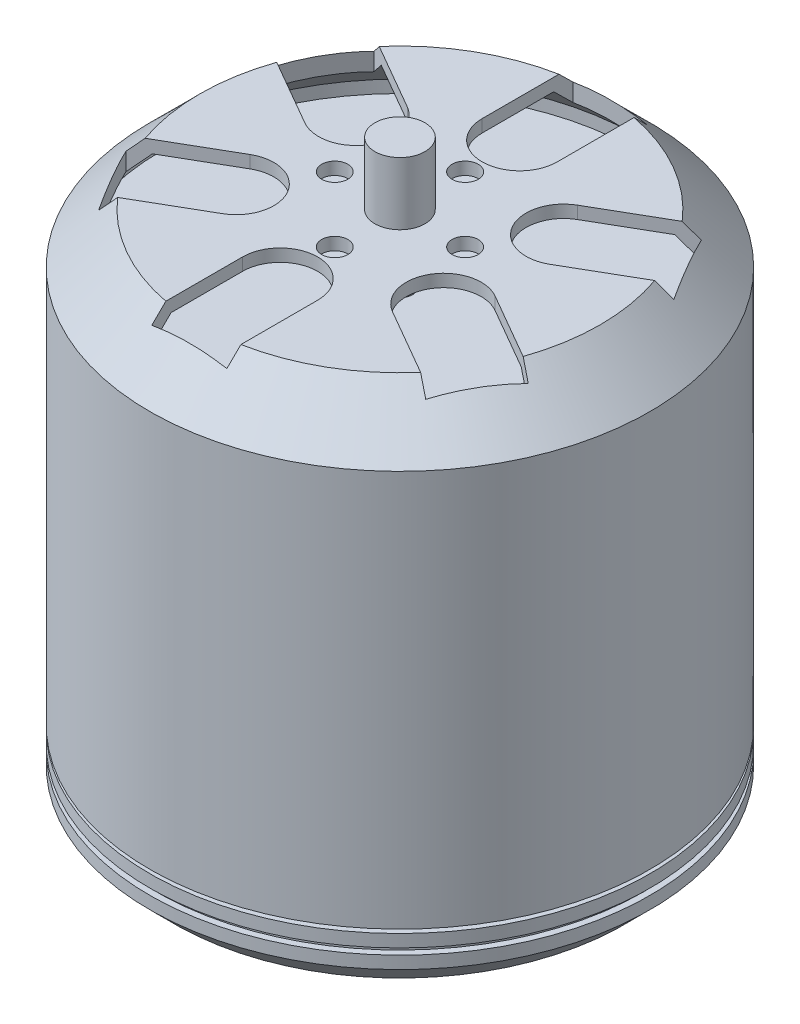
from build123d import *

# Parameters (mm, degrees)
SKETCH2_R          = 1.046208244
CUT_EXTRUDE1_DEPTH = 4
SKETCH3_R          = 1
CUT_EXTRUDE2_DEPTH = 3


with BuildPart() as part:
    # Sketch1 → Revolve1 (revolve)
    with BuildSketch(Plane.XY, mode=Mode.PRIVATE) as revolve1_sk:
        Polygon((0, 23.312815917), (0, 0), (0, -22.187184083), (10.054416675, -22.187184083), (18, -22.187184083), (20, -20.187184083), (20, -19.187184083), (19.5, -19.187184083), (19.5, -18.687184083), (20, -18.687184083), (20, -17.687184083), (18, -17.687184083), (18, -17.387184083), (20, -17.387184083), (20, 14.312815917), (16, 18.312815917), (2, 18.312815917), (2, 23.312815917), align=None)
        Polygon((2, 17.312815917), (15.585786438, 17.312815917), (19, 13.898602354), (19, 12.898602354), (1, 12.898602354), (1, 16.312815917), (2, 16.312815917), align=None, mode=Mode.SUBTRACT)
    revolve(revolve1_sk.sketch.rotate(Axis((0, 23.312815917, 0), (0, -1, 0)), 180), axis=Axis((0, 23.312815917, 0), (0, -1, 0)))

    # Sketch2 → Cut-Extrude1 (cut)
    with BuildSketch(Plane(origin=(0, 18.312815917, 0), x_dir=(1, 0, 0), z_dir=(0, 1, 0))):
        with Locations(Location((0, -5.211771178, 0), (0, 0, 270))):
            Circle(SKETCH2_R)
        with Locations(Location((-5.211771178, 0, 0), (0, 0, 270))):
            Circle(SKETCH2_R)
        with Locations(Location((0, 5.211771178, 0), (0, 0, 270))):
            Circle(SKETCH2_R)
        with Locations(Location((5.211771178, 0, 0), (0, 0, 270))):
            Circle(SKETCH2_R)
        with BuildLine():
            Line((-3, 9.577417814), (-3, 16.838236804))
            Line((-3, 16.838236804), (3, 16.838236804))
            Line((3, 16.838236804), (3, 9.577417814))
            ThreePointArc((3, 9.577417814), (0, 6.577417814), (-3, 9.577417814))
        make_face()
        with BuildLine():
            Line((16.082340827, 5.821042191), (9.794287129, 2.190632695))
            ThreePointArc((9.794287129, 2.190632695), (5.696210918, 3.288708907), (6.794287129, 7.386785118))
            Line((6.794287129, 7.386785118), (13.082340827, 11.017194613))
            Line((13.082340827, 11.017194613), (16.082340827, 5.821042191))
        make_face()
        with BuildLine():
            Line((13.082340827, -11.017194613), (6.794287129, -7.386785118))
            ThreePointArc((6.794287129, -7.386785118), (5.696210918, -3.288708907), (9.794287129, -2.190632695))
            Line((9.794287129, -2.190632695), (16.082340827, -5.821042191))
            Line((16.082340827, -5.821042191), (13.082340827, -11.017194613))
        make_face()
        with BuildLine():
            Line((-3, -16.838236804), (-3, -9.577417814))
            ThreePointArc((-3, -9.577417814), (0, -6.577417814), (3, -9.577417814))
            Line((3, -9.577417814), (3, -16.838236804))
            Line((3, -16.838236804), (-3, -16.838236804))
        make_face()
        with BuildLine():
            Line((-16.082340827, -5.821042191), (-9.794287129, -2.190632695))
            ThreePointArc((-9.794287129, -2.190632695), (-5.696210918, -3.288708907), (-6.794287129, -7.386785118))
            Line((-6.794287129, -7.386785118), (-13.082340827, -11.017194613))
            Line((-13.082340827, -11.017194613), (-16.082340827, -5.821042191))
        make_face()
        with BuildLine():
            Line((-13.082340827, 11.017194613), (-6.794287129, 7.386785118))
            ThreePointArc((-6.794287129, 7.386785118), (-5.696210918, 3.288708907), (-9.794287129, 2.190632695))
            Line((-9.794287129, 2.190632695), (-16.082340827, 5.821042191))
            Line((-16.082340827, 5.821042191), (-13.082340827, 11.017194613))
        make_face()
    extrude(amount=-CUT_EXTRUDE1_DEPTH, mode=Mode.SUBTRACT)

    # Sketch3 → Cut-Extrude2 (cut)
    with BuildSketch(Plane.XZ.offset(22.187184083)):
        with Locations(Location((0, -9.5, 0), (0, 0, 270))):
            Circle(SKETCH3_R)
        with Locations(Location((-12.5, 0, 0), (0, 0, 270))):
            Circle(SKETCH3_R)
        with Locations(Location((0, 9.5, 0), (0, 0, 270))):
            Circle(SKETCH3_R)
        with Locations(Location((12.5, 0, 0), (0, 0, 270))):
            Circle(SKETCH3_R)
    extrude(amount=-CUT_EXTRUDE2_DEPTH, mode=Mode.SUBTRACT)


solid = part.part
